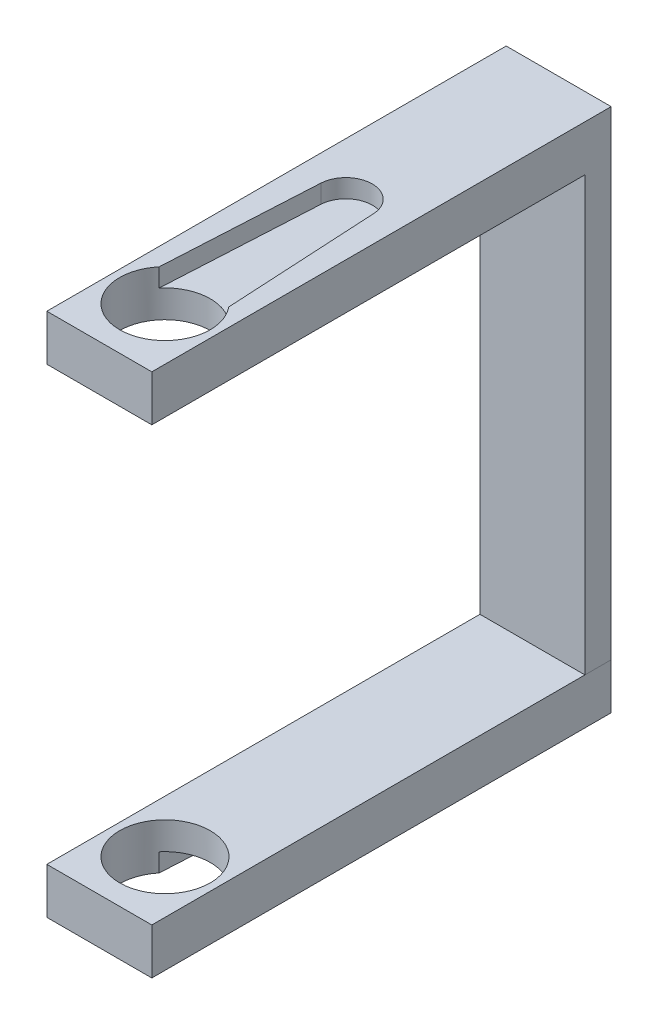
from build123d import *

# Parameters (mm, degrees)
BOSS_EXTRUDE2_DEPTH   = 35
BOSS_EXTRUDE2_2_DEPTH = 35
BOSS_EXTRUDE3_DEPTH   = 2
CUT_EXTRUDE2_DEPTH    = 1.4
SKETCH5_R             = 3.450000000000001
CUT_EXTRUDE3_DEPTH    = 2.1
CUT_EXTRUDE4_START    = -1.4
CUT_EXTRUDE4_DEPTH    = 1.4
CUT_EXTRUDE5_START    = -3.5
SKETCH7_R             = 3.4500000000000144
CUT_EXTRUDE5_DEPTH    = 2.1


with BuildPart() as part:
    # Sketch2 → Boss-Extrude2 (new body)
    with BuildSketch(Plane.XY):
        Polygon((-0.6815453945675554, 4.886493048426679), (-8.681545394567557, 4.88649304842668), (-8.681545394567557, 1.3864930484266802), (-0.6815453945675554, 1.3864930484266802), align=None)
    extrude(amount=BOSS_EXTRUDE2_DEPTH)

    # Sketch2<3> → Boss-Extrude3 (add)
    with BuildSketch(Plane.XY):
        Polygon((-0.6815453945675554, 1.3864930484266802), (-8.681545394567557, 1.3864930484266802), (-8.681545394567554, -31.61350695157332), (-0.6815453945675483, -31.61350695157332), align=None)
    extrude(amount=BOSS_EXTRUDE3_DEPTH)

    # Sketch3 → Cut-Extrude2 (cut)
    with BuildSketch(Plane(origin=(5.3e-16, 4.886493048426679, 0), x_dir=(1, 0, 0), z_dir=(0, 1, 0))):
        with BuildLine():
            Line((-2.670049230365411, -16.10578751916768), (-2.031545394567679, -27.790927796562404))
            ThreePointArc((-2.031545394567679, -27.790927796562404), (-4.681545394567368, -33.45), (-7.331545394567679, -27.7909277965627))
            Line((-7.331545394567679, -27.7909277965627), (-6.6930415587699335, -16.10578751916768))
            ThreePointArc((-6.6930415587699335, -16.10578751916768), (-4.681545394567673, -14.201203572244038), (-2.670049230365411, -16.10578751916768))
        make_face()
    extrude(amount=-CUT_EXTRUDE2_DEPTH, mode=Mode.SUBTRACT)

    # Sketch5 → Cut-Extrude3 (cut)
    with BuildSketch(Plane(origin=(0, 3.4864930484266785, 0), x_dir=(1, 0, 0), z_dir=(0, 1, 0))):
        with Locations(Location((-4.681545394567557, -30.000000000000004, 0), (0, 0, 270))):
            Circle(SKETCH5_R)
    extrude(amount=-CUT_EXTRUDE3_DEPTH, mode=Mode.SUBTRACT)


with BuildPart() as body_2:
    # Sketch2 → Boss-Extrude2 2 (new body)
    with BuildSketch(Plane.XY):
        Polygon((-8.681545394567554, -35.11350695157332), (-8.681545394567554, -31.61350695157332), (-0.6815453945675478, -31.61350695157332), (-0.6815453945675509, -35.11350695157332), align=None)
    extrude(amount=BOSS_EXTRUDE2_2_DEPTH)

    # Sketch6 → Cut-Extrude4 (cut)
    with BuildSketch(Plane.XZ.offset(35.11350695157332).offset(CUT_EXTRUDE4_START)):
        with BuildLine():
            Line((-6.693041558769597, 16.105787519167798), (-7.331545394567415, 27.790927796562364))
            ThreePointArc((-7.331545394567415, 27.790927796562364), (-4.681545394567741, 33.45000000000002), (-2.0315453945674466, 27.790927796562656))
            Line((-2.0315453945674466, 27.790927796562656), (-2.670049230365082, 16.10578751916783))
            ThreePointArc((-2.670049230365082, 16.10578751916783), (-4.681545394567325, 14.201203572244175), (-6.693041558769597, 16.105787519167798))
        make_face()
    extrude(amount=CUT_EXTRUDE4_DEPTH, mode=Mode.SUBTRACT)

    # Sketch7 → Cut-Extrude5 (cut)
    with BuildSketch(Plane.XZ.offset(35.11350695157332).offset(CUT_EXTRUDE5_START)):
        with Locations(Location((-4.681545394567552, 30.000000000000004, 0), (0, 0, 219.814997755))):
            Circle(SKETCH7_R)
    extrude(amount=CUT_EXTRUDE5_DEPTH, mode=Mode.SUBTRACT)


solid = Compound([part.part, body_2.part])
